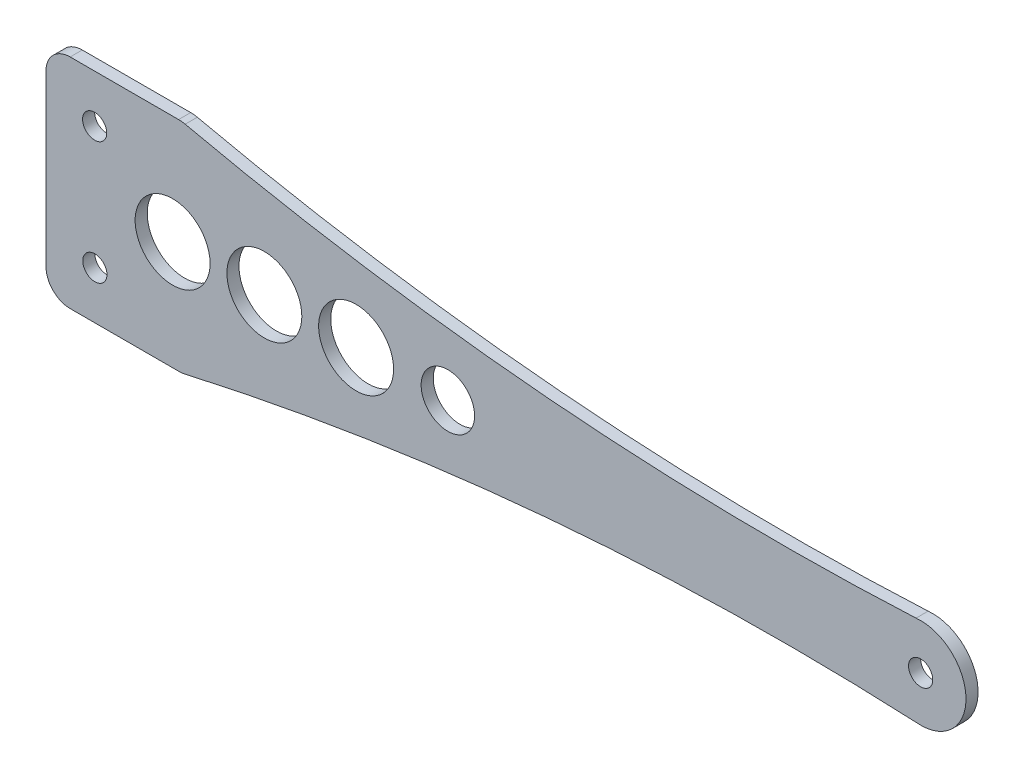
from build123d import *

# Parameters (mm, degrees)
CROQUIS1_R              = 2
CROQUIS1_R_2            = 6.198274882
CROQUIS1_R_3            = 4.419717803
SALIENTE_EXTRUIR1_DEPTH = 2


with BuildPart() as part:
    # Croquis1 → Saliente-Extruir1 (new body)
    with BuildSketch(Plane.XY):
        with BuildLine():
            Line((2268.277850574, 1595.161717739), (2286.209587358, 1595.161717739))
            ThreePointArc((2286.209587358, 1595.161717739), (2286.758807426, 1595.131461929), (2287.301380655, 1595.041060665))
            ThreePointArc((2287.301380655, 1595.041060665), (2347.39348888, 1585.799291159), (2408.182765081, 1584.733611347))
            ThreePointArc((2408.182765081, 1584.733611347), (2416.444223404, 1577.280241595), (2408.198435589, 1569.809538977))
            ThreePointArc((2408.198435589, 1569.809538977), (2347.38385613, 1568.613783021), (2287.284769189, 1559.236008449))
            ThreePointArc((2287.284769189, 1559.236008449), (2286.73687453, 1559.143781296), (2286.18213001, 1559.112911855))
            Line((2286.18213001, 1559.112911855), (2268.277850574, 1559.112911855))
            ThreePointArc((2268.277850574, 1559.112911855), (2265.449423449, 1560.284484731), (2264.277850574, 1563.112911855))
            Line((2264.277850574, 1563.112911855), (2264.277850574, 1591.161717739))
            ThreePointArc((2264.277850574, 1591.161717739), (2265.449423449, 1593.990144863), (2268.277850574, 1595.161717739))
        make_face()
        with Locations((2272.325487006, 1587.265174947)):
            Circle(CROQUIS1_R, mode=Mode.SUBTRACT)
        with Locations((2408.944227539, 1577.272366482)):
            Circle(CROQUIS1_R, mode=Mode.SUBTRACT)
        with Locations((2272.360522717, 1567.00968004)):
            Circle(CROQUIS1_R, mode=Mode.SUBTRACT)
        with Locations((2285.218970732, 1577.142453031)):
            Circle(CROQUIS1_R_2, mode=Mode.SUBTRACT)
        with Locations((2300.394517149, 1577.158387592)):
            Circle(CROQUIS1_R_2, mode=Mode.SUBTRACT)
        with Locations((2315.570063567, 1577.174322153)):
            Circle(CROQUIS1_R_2, mode=Mode.SUBTRACT)
        with Locations((2330.745609984, 1577.190256713)):
            Circle(CROQUIS1_R_3, mode=Mode.SUBTRACT)
    extrude(amount=SALIENTE_EXTRUIR1_DEPTH)


solid = part.part
